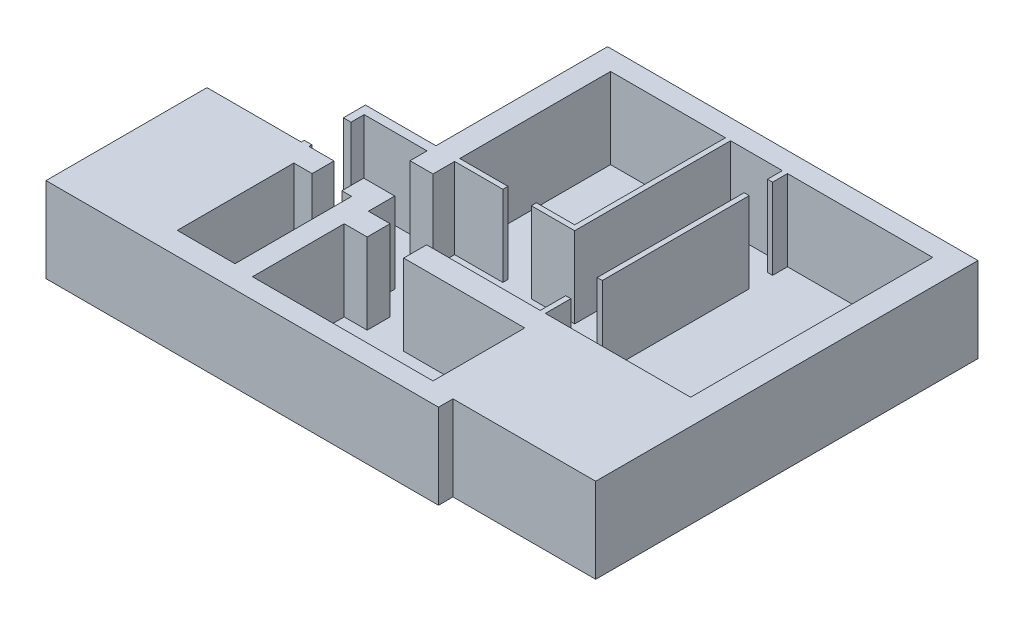
from build123d import *

# Parameters (mm, degrees)
EXTRUDE_1_DEPTH   = 1900
SKETCH_1_W        = 120
SKETCH_1_H        = 3460
EXTRUDE_1_2_DEPTH = 1900
EXTRUDE_2_DEPTH   = 100


with BuildPart() as part:
    # Эскиз1 → Бобышка-Вытянуть1 (new body)
    with BuildSketch(Plane(origin=(0, 0, 0), x_dir=(1, 0, 0), z_dir=(0, 1, 0))):
        Polygon((-12600, 0), (-12600, 3790), (-10380, 3790), (-10380, 3860), (-10200, 3860), (-10200, 3790), (-9610, 3790), (-9610, 3275), (-10040, 3275), (-10040, 530), (-8680, 530), (-8680, 3275), (-8910, 3275), (-8910, 3790), (-8180, 3790), (-8180, 3170), (-7670, 3170), (-7670, 2630), (-8210, 2630), (-8210, 470), (-3960, 470), (-3960, 2630), (-6810, 2630), (-6810, 3170), (-4135, 3170), (-4135, 3770), (-4015, 3770), (-4015, 3170), (-595, 3170), (-595, 8870), (-4015, 8870), (-4015, 8520), (-4135, 8520), (-4135, 8870), (-5355, 8870), (-5355, 5200), (-6375, 5200), (-6375, 5320), (-5475, 5320), (-5475, 8870), (-8180, 8870), (-8180, 5320), (-7045, 5320), (-7045, 5200), (-8180, 5200), (-8180, 4690), (-8720, 4690), (-8720, 5090), (-10200, 5090), (-10200, 4780), (-10380, 4780), (-10380, 5300), (-8720, 5300), (-8720, 9340), (0, 9340), (0, 2250), (0, 340), (-3360, 340), (-3360, 0), align=None)
    extrude(amount=EXTRUDE_1_DEPTH)



with BuildPart() as body_2:
    # Эскиз1 → Extrude 1 2 (new body)
    with BuildSketch(Plane(origin=(0, 0, 0), x_dir=(1, 0, 0), z_dir=(0, 1, 0))):
        with Locations((-4075, 6240)):
            Rectangle(SKETCH_1_W, SKETCH_1_H)
    extrude(amount=EXTRUDE_1_2_DEPTH)


with BuildPart() as part_1:
    add(part.part)

    add(body_2.part)  # Бобышка-Вытянуть2 merges body 2
    # Эскиз2 → Бобышка-Вытянуть2 (add)
    with BuildSketch(Plane.XZ):
        Polygon((0, -9340), (-8720, -9340), (-8720, -5300), (-10380, -5300), (-10380, -3790), (-12600, -3790), (-12600, 0), (-3360, 0), (-3360, -340), (0, -340), align=None)
    extrude(amount=EXTRUDE_2_DEPTH)


solid = part_1.part
